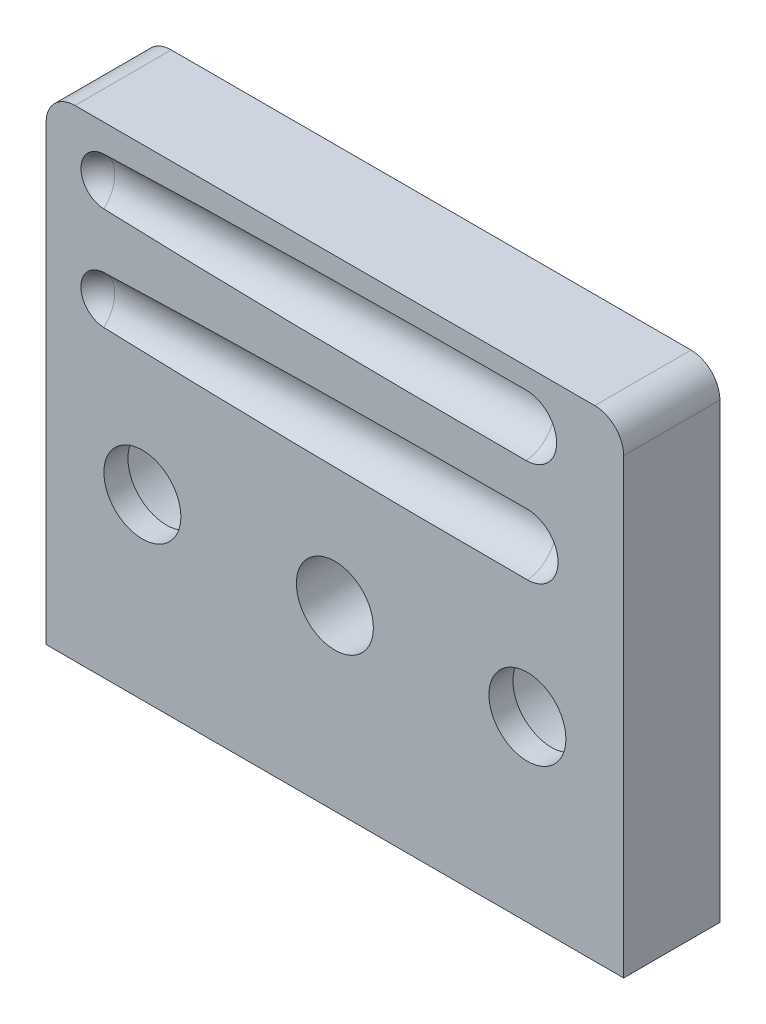
from build123d import *

# Parameters (mm, degrees)
ESQUISSE1_W             = 60
ESQUISSE1_H             = 50
BASE_EXTRUSION_DEPTH    = 10
CONG_1_R                = 3
ESQUISSE2_R             = 4
ENL_V_MAT_EXTRU_1_DEPTH = 10
ESQUISSE8_R             = 6.75
ENL_V_MAT_EXTRU_2_DEPTH = 7.5
ESQUISSE9_R             = 6.75
ENL_V_MAT_EXTRU_3_DEPTH = 4


with BuildPart() as part:
    # Esquisse1 → Base-Extrusion (new body)
    with BuildSketch(Plane.XY):
        with Locations((0, 6.5)):
            Rectangle(ESQUISSE1_W, ESQUISSE1_H)
    extrude(amount=BASE_EXTRUSION_DEPTH)

    # Congé1
    cong_1_edges = [part.edges().sort_by_distance(p)[0] for p in [
        (30, 31.5, 5),
        (-30, 31.5, 5),
    ]]
    fillet(cong_1_edges, radius=CONG_1_R)

    # Esquisse2 → Enlèv. mat.-Extru.1 (cut)
    with BuildSketch(Plane.XY.offset(10)):
        with Locations((-20, 0)):
            Circle(ESQUISSE2_R)
        Circle(ESQUISSE2_R)
        with Locations((20, 0)):
            Circle(ESQUISSE2_R)
    extrude(amount=-ENL_V_MAT_EXTRU_1_DEPTH, mode=Mode.SUBTRACT)

    # Esquisse6 → Enlever de la matière-Révolution1 (revolve, cut)
    with BuildSketch(Plane(origin=(0.494318915, 0, 10.885747795), x_dir=(0.9989705697907147, 0, -0.045362988129253885), z_dir=(0.045362988129253885, 0, 0.9989705697907147))):
        with BuildLine():
            Line((-24.428923556, 29.335740857), (19.387068756, 29.335740857))
            ThreePointArc((19.387068756, 29.335740857), (21.632132786, 28.405804888), (22.562068756, 26.160740857))
            Line((22.562068756, 26.160740857), (-27.603923556, 26.160740857))
            ThreePointArc((-27.603923556, 26.160740857), (-26.673987587, 28.405804888), (-24.428923556, 29.335740857))
        make_face()
    revolve(axis=Axis((-32.471709888, 26.160740857, 12.382726403), (0.9989705697907147, 0, -0.04536298812925389)), mode=Mode.SUBTRACT)

    # Esquisse7 → Enlever de la matière-Révolution2 (revolve, cut)
    with BuildSketch(Plane(origin=(0.494318915, 0, 10.885747795), x_dir=(0.9989705697907147, 0, -0.045362988129253885), z_dir=(0.045362988129253885, 0, 0.9989705697907147))):
        with BuildLine():
            Line((-24.428923556, 12.32), (19.525781515, 12.32))
            ThreePointArc((19.525781515, 12.32), (21.774381079, 13.251400436), (22.705781515, 15.5))
            Line((22.705781515, 15.5), (-27.608923556, 15.5))
            ThreePointArc((-27.608923556, 15.5), (-26.67752312, 13.251400436), (-24.428923556, 12.32))
        make_face()
    revolve(axis=Axis((-33.470680458, 15.5, 12.428089391), (0.9989705697907147, 0, -0.0453629881292539)), mode=Mode.SUBTRACT)

    # Esquisse8 → Enlèv. mat.-Extru.2 (cut)
    with BuildSketch(Plane(origin=(0, 0, 0), x_dir=(-1, 0, 0), z_dir=(0, 0, -1))):
        with Locations((-20, 0)):
            Circle(ESQUISSE8_R)
        with Locations((20, 0)):
            Circle(ESQUISSE8_R)
    extrude(amount=-ENL_V_MAT_EXTRU_2_DEPTH, mode=Mode.SUBTRACT)

    # Esquisse9 → Enlèv. mat.-Extru.3 (cut)
    with BuildSketch(Plane(origin=(0, 0, 0), x_dir=(-1, 0, 0), z_dir=(0, 0, -1))):
        Circle(ESQUISSE9_R)
    extrude(amount=-ENL_V_MAT_EXTRU_3_DEPTH, mode=Mode.SUBTRACT)


solid = part.part
